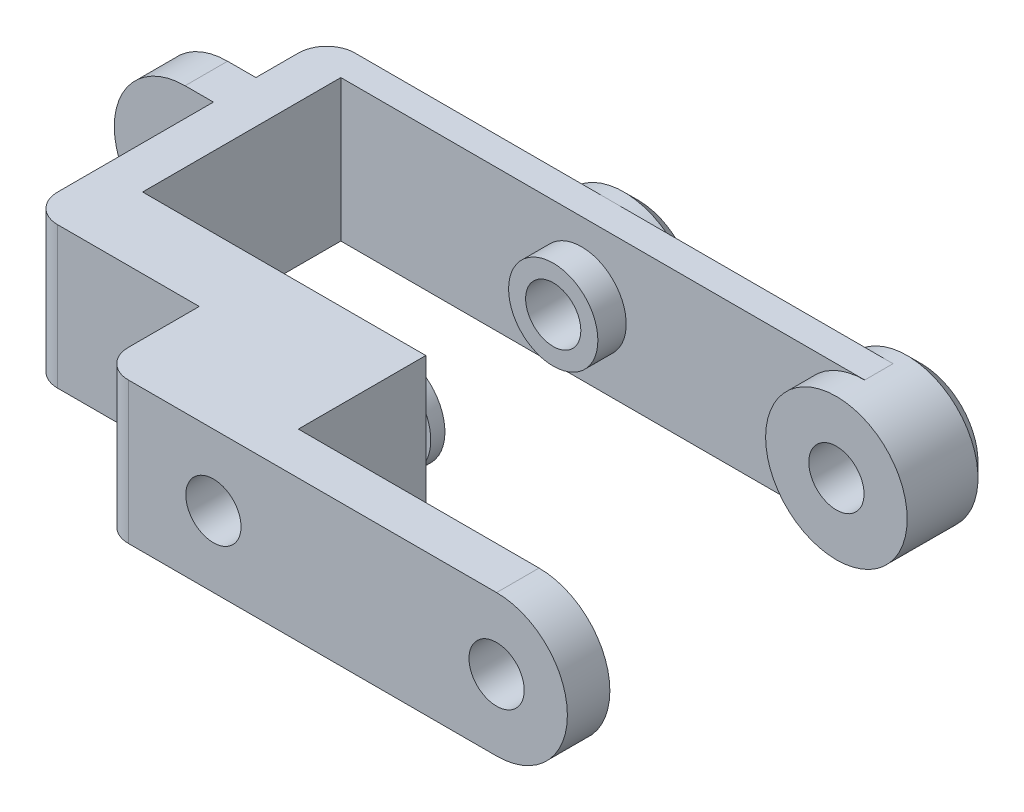
from build123d import *

# Parameters (mm, degrees)
CROQUIS1_R                 = 1.95
CROQUIS1_R_2               = 1
SALIENTE_EXTRUIR1_DEPTH    = 14
CORTAR_EXTRUIR1_DEPTH      = 33.015621187
CORTAR_EXTRUIR1_DEPTH_BACK = 33.015621187
CROQUIS2_W                 = 7
CROQUIS2_H                 = 5
REDONDEO1_R                = 2
CROQUIS3_R                 = 5
CROQUIS3_R_2               = 1.95
CROQUIS3_R_3               = 3.152955169
SALIENTE_EXTRUIR2_DEPTH    = 2
SALIENTE_EXTRUIR3_START    = 1
CROQUIS4_R                 = 3.35
CROQUIS4_R_2               = 1.95
SALIENTE_EXTRUIR3_DEPTH    = 1
SALIENTE_EXTRUIR4_START    = 2
CROQUIS5_R                 = 5
CROQUIS5_R_2               = 1.95
SALIENTE_EXTRUIR4_DEPTH    = 2
CHAFL_N1_SIZE              = 1


with BuildPart() as part:
    # Croquis1 → Saliente-Extruir1 (new, symmetric)
    with BuildSketch(Plane.XY):
        with BuildLine():
            Line((-22, 5), (20, 5))
            ThreePointArc((20, 5), (25, 0), (20, -5))
            Line((20, -5), (-22, -5))
            ThreePointArc((-22, -5), (-27, 0), (-22, 5))
        make_face()
        Circle(CROQUIS1_R, mode=Mode.SUBTRACT)
        with Locations((20, 0)):
            Circle(CROQUIS1_R, mode=Mode.SUBTRACT)
        with Locations((-22, 0)):
            Circle(CROQUIS1_R_2, mode=Mode.SUBTRACT)
    extrude(amount=SALIENTE_EXTRUIR1_DEPTH, both=True)

    # Croquis2 → Cortar-Extruir1 (cut, two sides: drawn at the far end of the back side and taken through both)
    with BuildSketch(Plane(origin=(0, 5, 0), x_dir=(1, 0, 0), z_dir=(0, 1, 0)).offset(-CORTAR_EXTRUIR1_DEPTH_BACK)):
        Polygon((25, 12), (-17, 12), (-17, -2), (3, -2), (3, -11), (25, -11), align=None)
        with Locations((-23.5, 11.5)):
            Rectangle(CROQUIS2_W, CROQUIS2_H)
        Polygon((-27, -14), (-18.2, -14), (-8, -14), (-8, -7), (-20, -7), (-20, 6), (-27, 6), align=None)
    extrude(amount=CORTAR_EXTRUIR1_DEPTH + CORTAR_EXTRUIR1_DEPTH_BACK, mode=Mode.SUBTRACT)

    # Redondeo1
    redondeo1_edges = [part.edges().sort_by_distance(p)[0] for p in [
        (-20, 0, 7),
        (-8, 0, 14),
        (-20, 0, -14),
    ]]
    fillet(redondeo1_edges, radius=REDONDEO1_R)

    # Croquis3 → Saliente-Extruir2 (add)
    # profile 1 of 2: a face of its own
    with BuildSketch(Plane.XY.offset(-12)):
        with Locations(Location((20, 0, 0), (0, 0, 90))):
            Circle(CROQUIS3_R)
        with Locations((20, 0)):
            Circle(CROQUIS3_R_2, mode=Mode.SUBTRACT)
    # profile 2 of 2: a face of its own
    with BuildSketch(Plane.XY.offset(-12)):
        with Locations(Location((0, 0, 0), (0, 0, 180))):
            Circle(CROQUIS3_R_3)
        Circle(CROQUIS3_R_2, mode=Mode.SUBTRACT)
    extrude(amount=SALIENTE_EXTRUIR2_DEPTH)

    # Croquis4 → Saliente-Extruir3 (add)
    with BuildSketch(Plane(origin=(0, 0, 2), x_dir=(-1, 0, 0), z_dir=(0, 0, -1)).offset(SALIENTE_EXTRUIR3_START)):
        with Locations(Location((0, 0, 0), (0, 0, 153.575607921))):
            Circle(CROQUIS4_R)
        Circle(CROQUIS4_R_2, mode=Mode.SUBTRACT)
    extrude(amount=-SALIENTE_EXTRUIR3_DEPTH)

    # Croquis5 → Saliente-Extruir4 (add)
    # profile 1 of 2: a face of its own
    with BuildSketch(Plane(origin=(0, 0, -14), x_dir=(-1, 0, 0), z_dir=(0, 0, -1)).offset(SALIENTE_EXTRUIR4_START)):
        with Locations((-20, 0)):
            Circle(CROQUIS5_R)
        with Locations(Location((-20, 0, 0), (0, 0, 180))):
            Circle(CROQUIS5_R_2, mode=Mode.SUBTRACT)
    # profile 2 of 2: a face of its own
    with BuildSketch(Plane(origin=(0, 0, -14), x_dir=(-1, 0, 0), z_dir=(0, 0, -1)).offset(SALIENTE_EXTRUIR4_START)):
        with Locations(Location((0, 0, 0), (0, 0, 270))):
            Circle(CROQUIS5_R)
        Circle(CROQUIS5_R_2, mode=Mode.SUBTRACT)
    extrude(amount=-SALIENTE_EXTRUIR4_DEPTH)

    # Chaflán1
    chafl_n1_edges = [part.edges().sort_by_distance(p)[0] for p in [
        (25, 0, -16),
        (0, 5, -16),
    ]]
    chamfer(chafl_n1_edges, length=CHAFL_N1_SIZE)


solid = part.part
